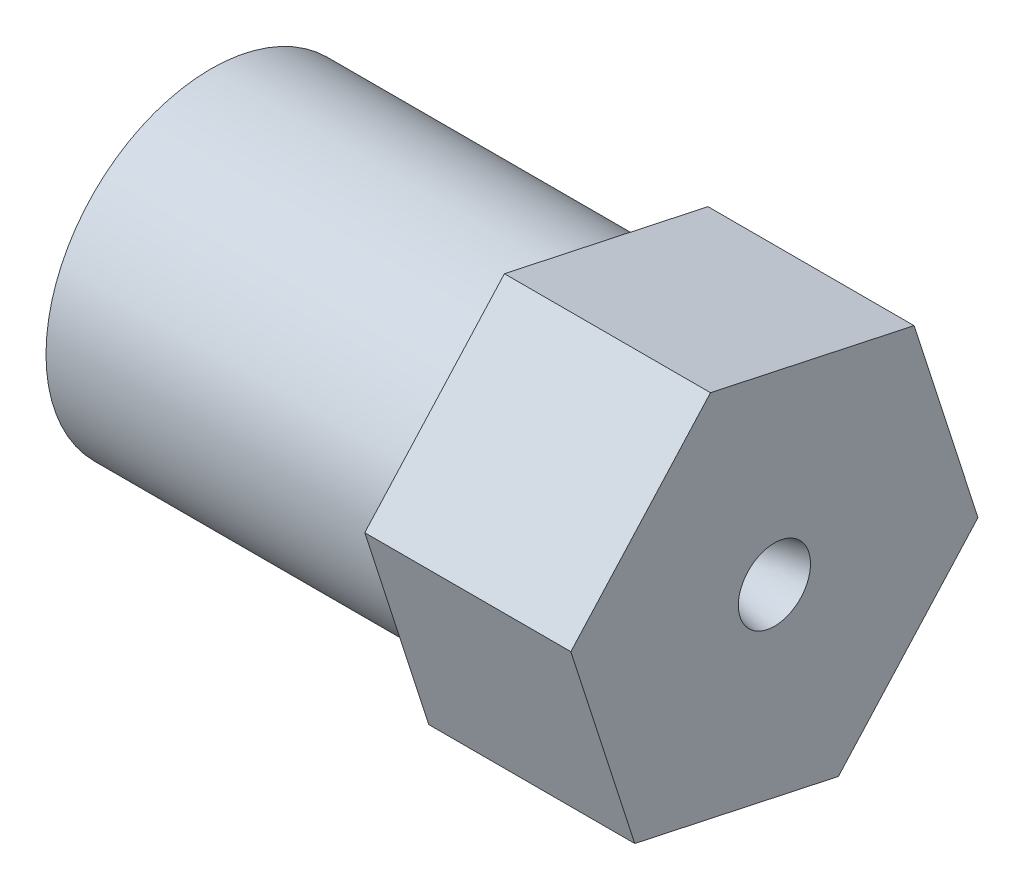
from build123d import *

# Parameters (mm, degrees)
SKETCH4_R           = 10.16
BOSS_EXTRUDE1_DEPTH = 12.7
FILLET1_R           = 0.635


with BuildPart() as part:
    # Sketch1 → Revolve1 (revolve)
    with BuildSketch(Plane.XY, mode=Mode.PRIVATE) as revolve1_sk:
        with BuildLine():
            Line((-1.590990258, 2.159009742), (-2.947044546, 3.51506403))
            ThreePointArc((-2.947044546, 3.51506403), (-3.977088678, 4.203317516), (-5.192108576, 4.445))
            Line((-5.192108576, 4.445), (-13.462, 4.445))
            Line((-13.462, 4.445), (-13.462, 4.699))
            ThreePointArc((-13.462, 4.699), (-13.499197439, 4.788802561), (-13.589, 4.826))
            Line((-13.589, 4.826), (-19.304, 4.826))
            ThreePointArc((-19.304, 4.826), (-19.753012806, 5.011987194), (-19.939, 5.461))
            Line((-19.939, 5.461), (-19.939, 6.8199))
            ThreePointArc((-19.939, 6.8199), (-19.976197439, 6.909702561), (-20.066, 6.9469))
            Line((-20.066, 6.9469), (-24.892, 6.9469))
            Line((-24.892, 6.9469), (-24.892, 7.8994))
            ThreePointArc((-24.892, 7.8994), (-24.929197439, 7.989202561), (-25.019, 8.0264))
            Line((-25.019, 8.0264), (-31.115, 8.0264))
            ThreePointArc((-31.115, 8.0264), (-31.564012806, 8.212387194), (-31.75, 8.6614))
            Line((-31.75, 8.6614), (-31.75, 10.16))
            Line((-31.75, 10.16), (-9.718936631, 10.16))
            Line((-9.718936631, 10.16), (2.981063369, 10.16))
            Line((2.981063369, 10.16), (2.981063369, 2.224859546))
            add(Edge.make_bspline(
                [(2.981063369, 2.224859546), (1.541449228, 2.022534973), (0.205212086, 1.536184427)],
                knots=[0, 0, 0, 1, 1, 1], degree=2))
            ThreePointArc((0.205212086, 1.536184427), (0.104188907, 1.509115348), (0, 1.5))
            ThreePointArc((0, 1.5), (-0.861037723, 1.671271052), (-1.590990258, 2.159009742))
        make_face()
    revolve(revolve1_sk.sketch.rotate(Axis((0, 0, 0), (1, 0, 0)), 90), axis=Axis((0, 0, 0), (1, 0, 0)))

    # Sketch4 → Boss-Extrude1 (add)
    with BuildSketch(Plane(origin=(2.981063369, 0, 0), x_dir=(0, 0, -1), z_dir=(1, 0, 0))):
        Polygon((3.940411868, -12.211607701), (12.545768424, -2.693307071), (8.605356556, 9.51830063), (-3.940411868, 12.211607701), (-12.545768424, 2.693307071), (-8.605356556, -9.51830063), align=None)
        with Locations(Location((0, 0, 0), (0, 0, 180))):
            Circle(SKETCH4_R, mode=Mode.SUBTRACT)
    extrude(amount=-BOSS_EXTRUDE1_DEPTH)

    # Fillet1
    fillet1_edges = [part.edges().sort_by_distance(p)[0] for p in [
        (-9.718936631, 0, -10.16),
    ]]
    fillet(fillet1_edges, radius=FILLET1_R)


solid = part.part
